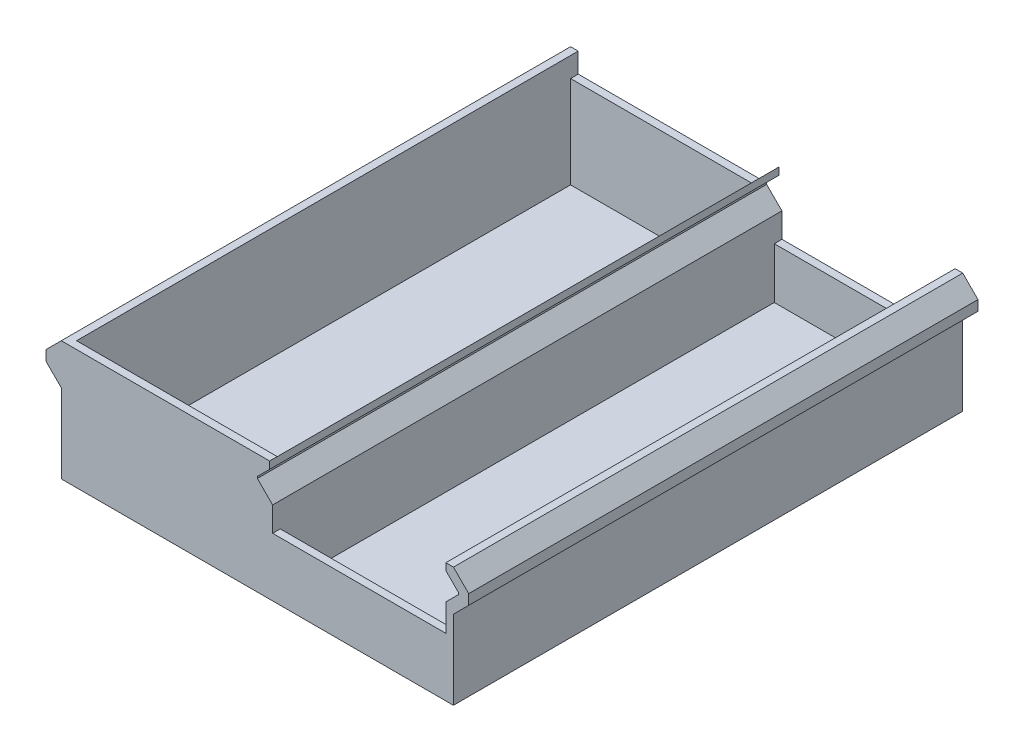
from build123d import *

# Parameters (mm, degrees)
EXTRUDE_1_DEPTH     = 200
SKETCH_2_W          = 148
SKETCH_2_H          = 194
CUT_EXTRUDE_1_DEPTH = 44
SKETCH_3_W          = 9
SKETCH_3_H          = 194
EXTRUDE_1_2_DEPTH   = 44
CUT_EXTRUDE_2_DEPTH = 222.580685079
CUT_EXTRUDE_3_DEPTH = 219.876677606


with BuildPart() as part:
    # 草图1 → Extrude 1 (new body)
    with BuildSketch(Plane.XY):
        Polygon((77, 0), (-77, 0), (-77, 31), (-83, 37), (-83, 41), (-77, 47), (77, 47), (83, 41), (83, 37), (77, 31), align=None)
    extrude(amount=-EXTRUDE_1_DEPTH)

    # 草图2 → 切除-拉伸1 (cut)
    with BuildSketch(Plane(origin=(0, 47, 0), x_dir=(1, 0, 0), z_dir=(0, 1, 0))):
        with Locations((0, 100)):
            Rectangle(SKETCH_2_W, SKETCH_2_H)
    extrude(amount=-CUT_EXTRUDE_1_DEPTH, mode=Mode.SUBTRACT)

    # 草图3 → Extrude 1 2 (add)
    with BuildSketch(Plane(origin=(0, 3, 0), x_dir=(1, 0, 0), z_dir=(0, 1, 0))):
        with Locations((1.5, 100)):
            Rectangle(SKETCH_3_W, SKETCH_3_H)
    extrude(amount=EXTRUDE_1_2_DEPTH)

    # 草图5 → 切除-拉伸2 (cut, through all)
    with BuildSketch(Plane(origin=(0, 0, -200), x_dir=(-1, 0, 0), z_dir=(0, 0, -1))):
        Polygon((-74, 47), (-74, 44.343145751), (-79, 39.343145751), (-79, 38.656854249), (-74, 33.656854249), (-74, 23), (-6, 23), (-6, 32.656854249), (0, 38.656854249), (0, 39.343145751), (-4.7940469, 44.137192651), (-4.7940469, 47), align=None)
    extrude(amount=-CUT_EXTRUDE_2_DEPTH, mode=Mode.SUBTRACT)

    # 草图6 → 切除-拉伸3 (cut, through all)
    with BuildSketch(Plane(origin=(0, 0, -3), x_dir=(-1, 0, 0), z_dir=(0, 0, -1))):
        Polygon((-4.828427125, 47), (3, 47), (74, 47), (74, 39.171572875), (3, 39.171572875), align=None)
    extrude(amount=CUT_EXTRUDE_3_DEPTH, mode=Mode.SUBTRACT)


solid = part.part
